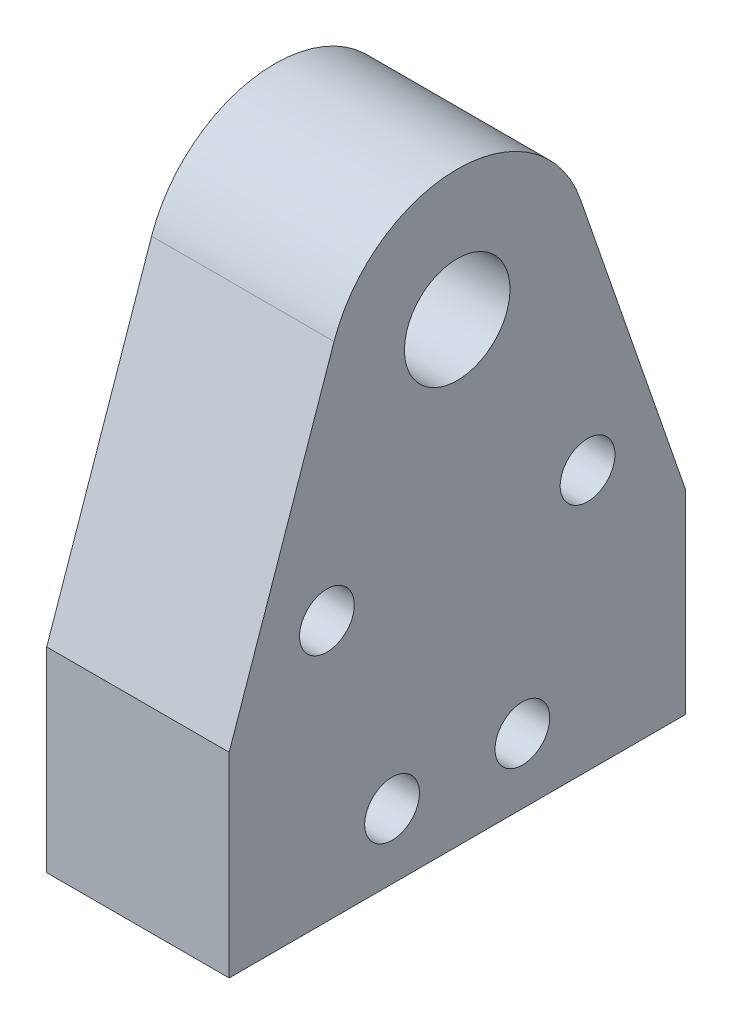
from build123d import *

# Parameters (mm, degrees)
SKETCH_1_W          = 14
SKETCH_1_H          = 35
EXTRUDE_1_DEPTH     = 60
CUT_EXTRUDE_1_DEPTH = 60
SKETCH_3_R          = 2.1
CUT_EXTRUDE_2_DEPTH = 10
SKETCH_4_R          = 4.05
CUT_EXTRUDE_3_DEPTH = 46
CUT_EXTRUDE_4_DEPTH = 100
SKETCH_7_R          = 4.05
EXTRUDE_3_DEPTH     = 2


with BuildPart() as part:
    # 草图1 → 凸台-拉伸1 (new body)
    with BuildSketch(Plane(origin=(0, 0, 0), x_dir=(1, 0, 0), z_dir=(0, 1, 0))):
        Rectangle(SKETCH_1_W, SKETCH_1_H)
    extrude(amount=EXTRUDE_1_DEPTH)

    # 草图2 → 切除-拉伸1 (cut)
    with BuildSketch(Plane(origin=(7, 0, 0), x_dir=(0, 0, -1), z_dir=(1, 0, 0))):
        with BuildLine():
            Line((-17.5, 15), (-9.450519182, 38.269202838))
            ThreePointArc((-9.450519182, 38.269202838), (-5.87e-07, 45), (9.450518798, 38.269203948))
            Line((9.450518798, 38.269203948), (17.5, 15))
            Line((17.5, 15), (17.5, 60))
            Line((17.5, 60), (-17.5, 60))
            Line((-17.5, 60), (-17.5, 15))
        make_face()
    extrude(amount=-CUT_EXTRUDE_1_DEPTH, mode=Mode.SUBTRACT)

    # 草图3 → 切除-拉伸2 (cut)
    with BuildSketch(Plane.XZ):
        with Locations(Location((0, -12.5, 0), (0, 0, 270))):
            Circle(SKETCH_3_R)
        with Locations(Location((0, 12.5, 0), (0, 0, 270))):
            Circle(SKETCH_3_R)
    extrude(amount=-CUT_EXTRUDE_2_DEPTH, mode=Mode.SUBTRACT)

    # 草图4 → 切除-拉伸3 (cut)
    with BuildSketch(Plane(origin=(7, 0, 0), x_dir=(0, 0, -1), z_dir=(1, 0, 0))):
        with Locations((0, 35)):
            Circle(SKETCH_4_R)
    extrude(amount=-CUT_EXTRUDE_3_DEPTH, mode=Mode.SUBTRACT)

    # 草图5 → 切除-拉伸4 (cut)
    with BuildSketch(Plane(origin=(7, 0, 0), x_dir=(0, 0, -1), z_dir=(1, 0, 0))):
        with BuildLine():
            ThreePointArc((-7.9, 20), (-11.48492424, 21.48492424), (-10, 17.9))
            Line((-10, 17.9), (-10, 20))
            Line((-10, 20), (-7.9, 20))
        make_face()
        with BuildLine():
            Line((-10, 20), (-10, 17.9))
            ThreePointArc((-10, 17.9), (-8.51507576, 18.51507576), (-7.9, 20))
            Line((-7.9, 20), (-10, 20))
        make_face()
        with BuildLine():
            ThreePointArc((-7.9, 20), (-11.48492424, 21.48492424), (-10, 17.9))
            Line((-10, 17.9), (-10, 20))
            Line((-10, 20), (-7.9, 20))
        make_face()
        with BuildLine():
            Line((-10, 20), (-10, 17.9))
            ThreePointArc((-10, 17.9), (-8.51507576, 18.51507576), (-7.9, 20))
            Line((-7.9, 20), (-10, 20))
        make_face()
        with BuildLine():
            ThreePointArc((7.9, 20), (8.51507576, 18.51507576), (10, 17.9))
            Line((10, 17.9), (10, 20))
            Line((10, 20), (7.9, 20))
        make_face()
        with BuildLine():
            Line((10, 20), (10, 17.9))
            ThreePointArc((10, 17.9), (11.48492424, 18.51507576), (12.1, 20))
            ThreePointArc((12.1, 20), (10, 22.1), (7.9, 20))
            Line((7.9, 20), (10, 20))
        make_face()
        with BuildLine():
            ThreePointArc((7.9, 20), (8.51507576, 18.51507576), (10, 17.9))
            Line((10, 17.9), (10, 20))
            Line((10, 20), (7.9, 20))
        make_face()
        with BuildLine():
            Line((10, 20), (10, 17.9))
            ThreePointArc((10, 17.9), (11.48492424, 18.51507576), (12.1, 20))
            ThreePointArc((12.1, 20), (10, 22.1), (7.9, 20))
            Line((7.9, 20), (10, 20))
        make_face()
        with BuildLine():
            ThreePointArc((2.9, 5), (5, 2.9), (7.1, 5))
            Line((7.1, 5), (2.9, 5))
        make_face()
        with BuildLine():
            Line((2.9, 5), (7.1, 5))
            ThreePointArc((7.1, 5), (5, 7.1), (2.9, 5))
        make_face()
        with BuildLine():
            ThreePointArc((2.9, 5), (5, 2.9), (7.1, 5))
            Line((7.1, 5), (2.9, 5))
        make_face()
        with BuildLine():
            Line((2.9, 5), (7.1, 5))
            ThreePointArc((7.1, 5), (5, 7.1), (2.9, 5))
        make_face()
        with BuildLine():
            ThreePointArc((-2.9, 5), (-5, 7.1), (-7.1, 5))
            Line((-7.1, 5), (-2.9, 5))
        make_face()
        with BuildLine():
            Line((-2.9, 5), (-7.1, 5))
            ThreePointArc((-7.1, 5), (-5, 2.9), (-2.9, 5))
        make_face()
        with BuildLine():
            ThreePointArc((-2.9, 5), (-5, 7.1), (-7.1, 5))
            Line((-7.1, 5), (-2.9, 5))
        make_face()
        with BuildLine():
            Line((-2.9, 5), (-7.1, 5))
            ThreePointArc((-7.1, 5), (-5, 2.9), (-2.9, 5))
        make_face()
    extrude(amount=-CUT_EXTRUDE_4_DEPTH, mode=Mode.SUBTRACT)


with BuildPart() as body_2:
    # 草图7 → 凸台-拉伸3 (new body)
    with BuildSketch(Plane.ZY.offset(7)):
        with Locations((0, 35)):
            Circle(SKETCH_7_R)
    extrude(amount=-EXTRUDE_3_DEPTH)


with BuildPart() as part_1:
    add(part.part)

    # Combine 1: union body 2
    add(body_2.part)


solid = part_1.part
